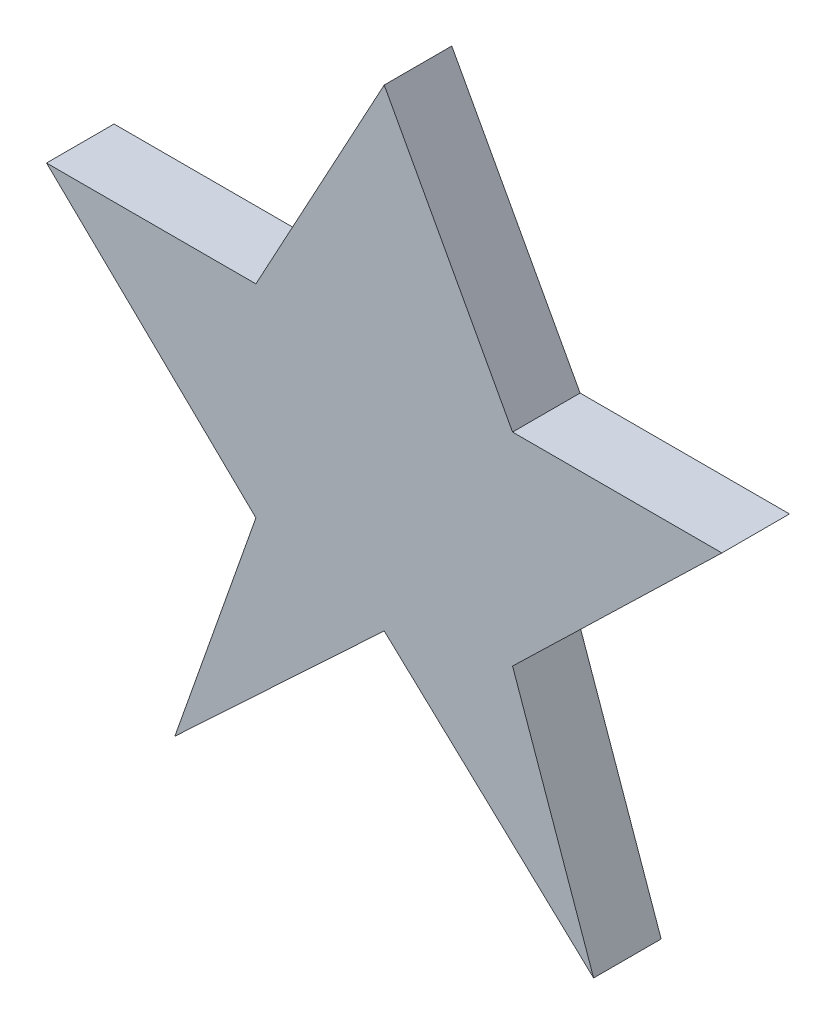
from build123d import *

# Parameters (mm, degrees)
EXTRUDE_1_DEPTH = 100


with BuildPart() as part:
    # 草图1 → 凸台-拉伸1 (new body)
    with BuildSketch(Plane.XY):
        Polygon((0, 500), (190, 150), (500, 150), (190, -150), (310, -490), (0, -200), (-310, -490), (-190, -150), (-500, 150), (-190, 150), align=None)
    extrude(amount=EXTRUDE_1_DEPTH)


solid = part.part
